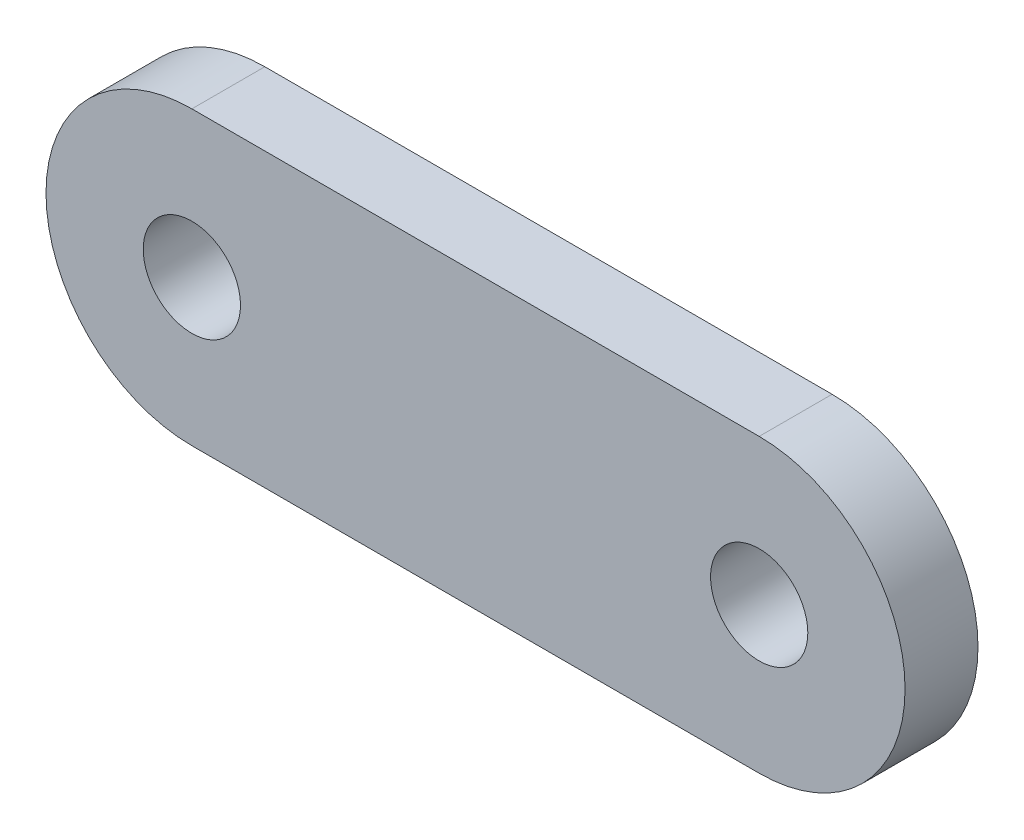
from build123d import *

# Parameters (mm, degrees)
SKETCH1_R           = 2
BOSS_EXTRUDE3_DEPTH = 3


with BuildPart() as part:
    # Sketch1 → Boss-Extrude3 (new body)
    with BuildSketch(Plane.XY):
        with BuildLine():
            Line((-35.312724167, 6), (-11.978624167, 6))
            ThreePointArc((-11.978624167, 6), (-5.978624167, 0), (-11.978624167, -6))
            Line((-11.978624167, -6), (-35.312724167, -6))
            ThreePointArc((-35.312724167, -6), (-41.312724167, 0), (-35.312724167, 6))
        make_face()
        with Locations((-35.312724167, 0)):
            Circle(SKETCH1_R, mode=Mode.SUBTRACT)
        with Locations((-11.978624167, 0)):
            Circle(SKETCH1_R, mode=Mode.SUBTRACT)
    extrude(amount=BOSS_EXTRUDE3_DEPTH)


solid = part.part
